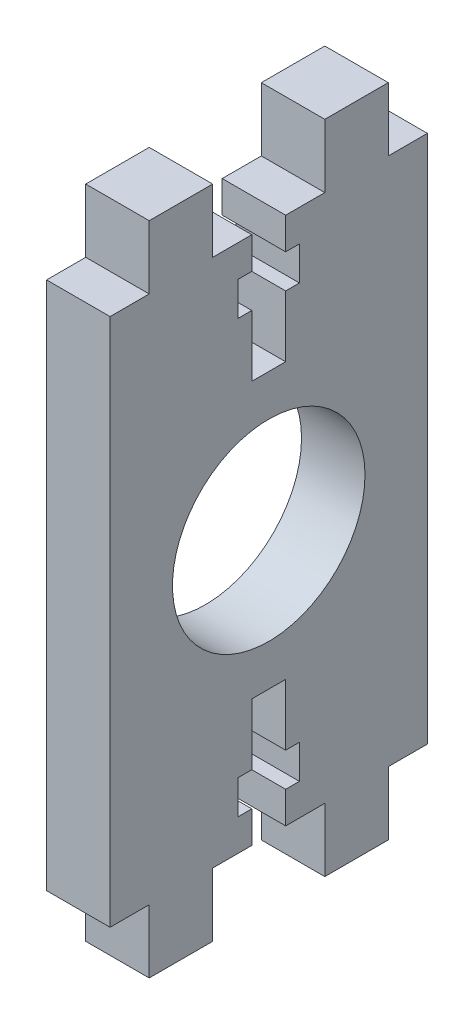
from build123d import *

# Parameters (mm, degrees)
SKETCH1_R           = 9.1
BOSS_EXTRUDE1_DEPTH = 6


with BuildPart() as part:
    # Sketch1 → Boss-Extrude1 (new body)
    with BuildSketch(Plane(origin=(0, 0, 0), x_dir=(0, 0, -1), z_dir=(1, 0, 0))):
        Polygon((-15, -25), (-15, 25), (-11.3, 25), (-11.3, 31), (-5.3, 31), (-5.3, 25), (-1.6, 25), (-1.6, 22), (-2.9, 22), (-2.9, 18.8), (-1.6, 18.8), (-1.6, 13), (1.6, 13), (1.6, 18.8), (2.9, 18.8), (2.9, 22), (1.6, 22), (1.6, 25), (5.3, 25), (5.3, 31), (11.3, 31), (11.3, 25), (15, 25), (15, -25), (11.3, -25), (11.3, -31), (5.3, -31), (5.3, -25), (1.6, -25), (1.6, -22), (2.9, -22), (2.9, -18.8), (1.6, -18.8), (1.6, -13), (-1.6, -13), (-1.6, -18.8), (-2.9, -18.8), (-2.9, -22), (-1.6, -22), (-1.6, -25), (-5.3, -25), (-5.3, -31), (-11.3, -31), (-11.3, -25), align=None)
        Circle(SKETCH1_R, mode=Mode.SUBTRACT)
    extrude(amount=BOSS_EXTRUDE1_DEPTH)


solid = part.part
